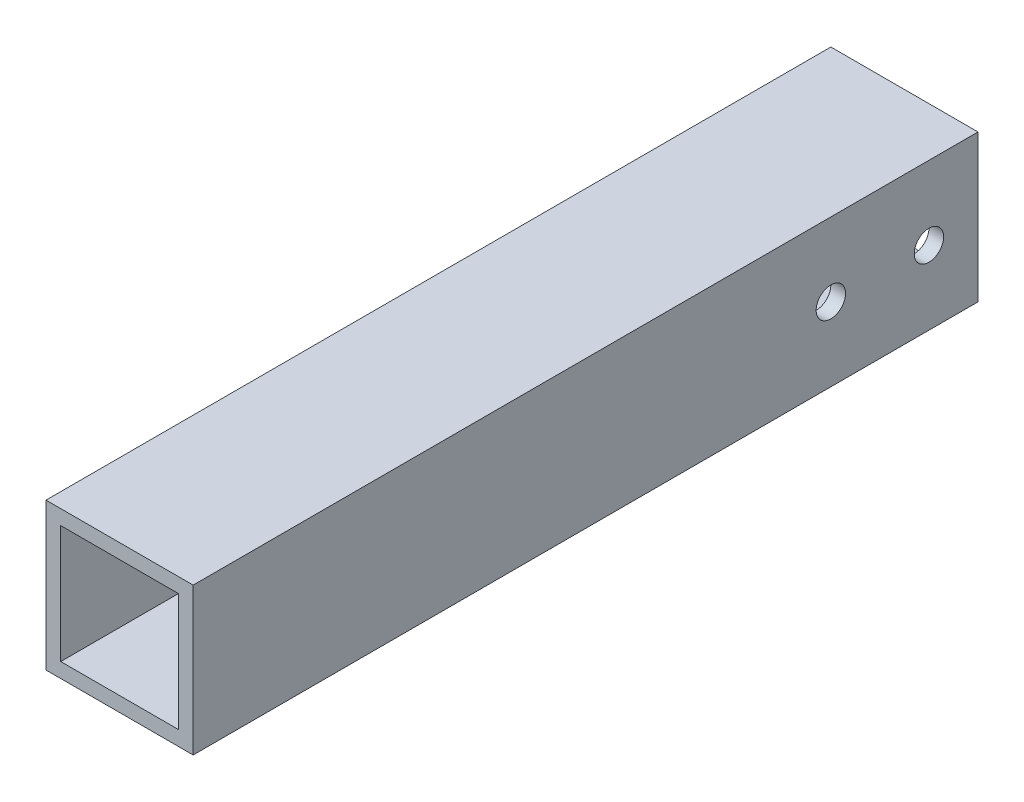
from build123d import *

# Parameters (mm, degrees)
ESQUISSE1_W             = 15
ESQUISSE1_H             = 15
EXTRUSION1_DEPTH        = 80
ESQUISSE2_W             = 12
ESQUISSE2_H             = 12
EXTRUSION2_DEPTH        = 81.700061958
ESQUISSE3_R             = 1.5
ENL_V_MAT_EXTRU_1_DEPTH = 82.738913621


with BuildPart() as part:
    # Esquisse1 → Extrusion1 (new body)
    with BuildSketch(Plane.XY):
        Rectangle(ESQUISSE1_W, ESQUISSE1_H)
    extrude(amount=EXTRUSION1_DEPTH)

    # Esquisse2 → Extrusion2 (cut, through all)
    with BuildSketch(Plane.XY.offset(80)):
        Rectangle(ESQUISSE2_W, ESQUISSE2_H)
    extrude(amount=-EXTRUSION2_DEPTH, mode=Mode.SUBTRACT)

    # Esquisse3 → Enlèv. mat.-Extru.1 (cut, through all)
    with BuildSketch(Plane(origin=(7.5, 0, 0), x_dir=(0, 0, -1), z_dir=(1, 0, 0))):
        with Locations((-5, 0)):
            Circle(ESQUISSE3_R)
        with Locations((-15, 0)):
            Circle(ESQUISSE3_R)
    extrude(amount=-ENL_V_MAT_EXTRU_1_DEPTH, mode=Mode.SUBTRACT)


solid = part.part
